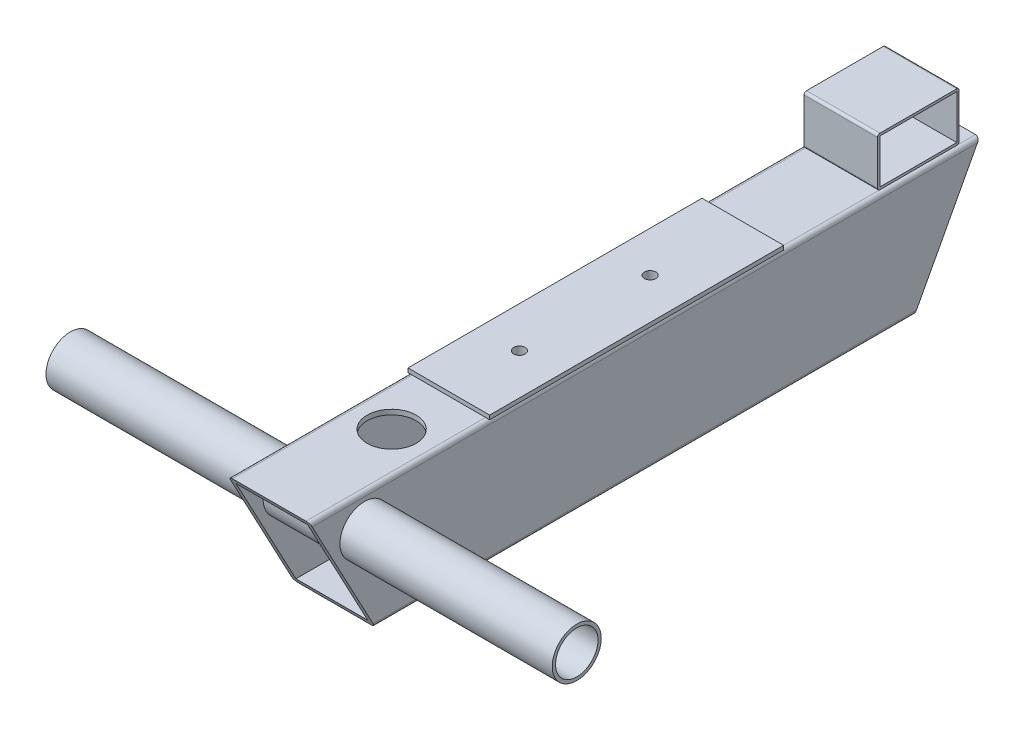
from build123d import *

# Parameters (mm, degrees)
SCHIZZO1_W                     = 88
SCHIZZO1_H                     = 138
ESTRUSIONE_SOTTILE1_DEPTH      = 1000
ESTRUSIONE1_DEPTH              = 1017.120071645
ESTRUSIONE2_DEPTH              = 1017.120071645
SCHIZZO4_R                     = 30
ESTRUSIONE3_DEPTH              = 1017.120071645
SCHIZZO12_R                    = 7
TAGLIO_ESTRUSIONE1_DEPTH       = 1017.120071645
SCHIZZO5_W                     = 100
SCHIZZO5_H                     = 360
ESTRUSIONE4_DEPTH              = 5
SCHIZZO6_R                     = 7
ESTRUSIONE5_DEPTH              = 1017.870198206
SCHIZZO9_R                     = 30
ESTRUSIONE8_DEPTH              = 1017.870198206
ESTRUSIONE_SOTTILE2_DEPTH      = 260
ESTRUSIONE_SOTTILE2_DEPTH_BACK = 360
SCHIZZO10_R                    = 30
SCHIZZO10_R_2                  = 26
ESTRUSIONE_SOTTILE3_START      = -5
SCHIZZO11_W                    = 94
SCHIZZO11_H                    = 54
ESTRUSIONE_SOTTILE3_DEPTH      = 90


with BuildPart() as part:
    # Schizzo1 → Estrusione-Sottile1 (new body)
    with BuildSketch(Plane.XY):
        with BuildLine():
            Line((5, 0), (95, 0))
            ThreePointArc((95, 0), (98.535533906, 1.464466094), (100, 5))
            Line((100, 5), (100, 145))
            ThreePointArc((100, 145), (98.535533906, 148.535533906), (95, 150))
            Line((95, 150), (5, 150))
            ThreePointArc((5, 150), (1.464466094, 148.535533906), (0, 145))
            Line((0, 145), (0, 5))
            ThreePointArc((0, 5), (1.464466094, 1.464466094), (5, 0))
        make_face()
        with Locations((50, 75)):
            Rectangle(SCHIZZO1_W, SCHIZZO1_H, mode=Mode.SUBTRACT)
    extrude(amount=ESTRUSIONE_SOTTILE1_DEPTH)

    # Schizzo2 → Estrusione1 (cut, through all)
    with BuildSketch(Plane(origin=(100, 0, 0), x_dir=(0, 0, -1), z_dir=(1, 0, 0))):
        Polygon((-920, 0), (-1000, 150), (-1000, 0), align=None)
    extrude(amount=-ESTRUSIONE1_DEPTH, mode=Mode.SUBTRACT)

    # Schizzo3 → Estrusione2 (cut, through all)
    with BuildSketch(Plane(origin=(100, 0, 0), x_dir=(0, 0, -1), z_dir=(1, 0, 0))):
        Polygon((-180, 150), (-260, 0), (0, 0), (0, 150), align=None)
    extrude(amount=-ESTRUSIONE2_DEPTH, mode=Mode.SUBTRACT)

    # Schizzo4 → Estrusione3 (cut, through all)
    with BuildSketch(Plane.XZ):
        with Locations((50, 850)):
            Circle(SCHIZZO4_R)
    extrude(amount=-ESTRUSIONE3_DEPTH, mode=Mode.SUBTRACT)

    # Schizzo12 → Taglio-Estrusione1 (cut, through all)
    with BuildSketch(Plane(origin=(0, 150, 0), x_dir=(1, 0, 0), z_dir=(0, 1, 0))):
        with Locations((50, -693.5)):
            Circle(SCHIZZO12_R)
        with Locations((50, -533.5)):
            Circle(SCHIZZO12_R)
    extrude(amount=-TAGLIO_ESTRUSIONE1_DEPTH, mode=Mode.SUBTRACT)

    # Schizzo5 → Estrusione4 (add)
    with BuildSketch(Plane(origin=(0, 150, 0), x_dir=(1, 0, 0), z_dir=(0, 1, 0))):
        with Locations((50, -600)):
            Rectangle(SCHIZZO5_W, SCHIZZO5_H)
    extrude(amount=ESTRUSIONE4_DEPTH)

    # Schizzo6 → Estrusione5 (cut, through all)
    with BuildSketch(Plane(origin=(0, 155, 0), x_dir=(1, 0, 0), z_dir=(0, 1, 0))):
        with Locations((50, -533.5)):
            Circle(SCHIZZO6_R)
        with Locations((50, -693.5)):
            Circle(SCHIZZO6_R)
    extrude(amount=-ESTRUSIONE5_DEPTH, mode=Mode.SUBTRACT)

    # Schizzo9 → Estrusione8 (cut, through all)
    with BuildSketch(Plane(origin=(100, 0, 0), x_dir=(0, 0, -1), z_dir=(1, 0, 0))):
        with Locations((-933.333333333, 110)):
            Circle(SCHIZZO9_R)
    extrude(amount=-ESTRUSIONE8_DEPTH, mode=Mode.SUBTRACT)

    # Schizzo10 → Estrusione-Sottile2 (add, two sides: drawn at the far end of the back side and taken through both)
    with BuildSketch(Plane(origin=(100, 0, 0), x_dir=(0, 0, -1), z_dir=(1, 0, 0)).offset(-ESTRUSIONE_SOTTILE2_DEPTH_BACK)):
        with Locations((-933.333333333, 110)):
            Circle(SCHIZZO10_R)
        with Locations((-933.333333333, 110)):
            Circle(SCHIZZO10_R_2, mode=Mode.SUBTRACT)
    extrude(amount=ESTRUSIONE_SOTTILE2_DEPTH + ESTRUSIONE_SOTTILE2_DEPTH_BACK)

    # Schizzo11 → Estrusione-Sottile3 (add)
    with BuildSketch(Plane(origin=(100, 0, 0), x_dir=(0, 0, -1), z_dir=(1, 0, 0)).offset(ESTRUSIONE_SOTTILE3_START)):
        with BuildLine():
            Line((-297, 210), (-203, 210))
            ThreePointArc((-203, 210), (-200.878679656, 209.121320344), (-200, 207))
            Line((-200, 207), (-200, 153))
            ThreePointArc((-200, 153), (-200.878679656, 150.878679656), (-203, 150))
            Line((-203, 150), (-297, 150))
            ThreePointArc((-297, 150), (-299.121320344, 150.878679656), (-300, 153))
            Line((-300, 153), (-300, 207))
            ThreePointArc((-300, 207), (-299.121320344, 209.121320344), (-297, 210))
        make_face()
        with Locations((-250, 180)):
            Rectangle(SCHIZZO11_W, SCHIZZO11_H, mode=Mode.SUBTRACT)
    extrude(amount=-ESTRUSIONE_SOTTILE3_DEPTH)


solid = part.part
